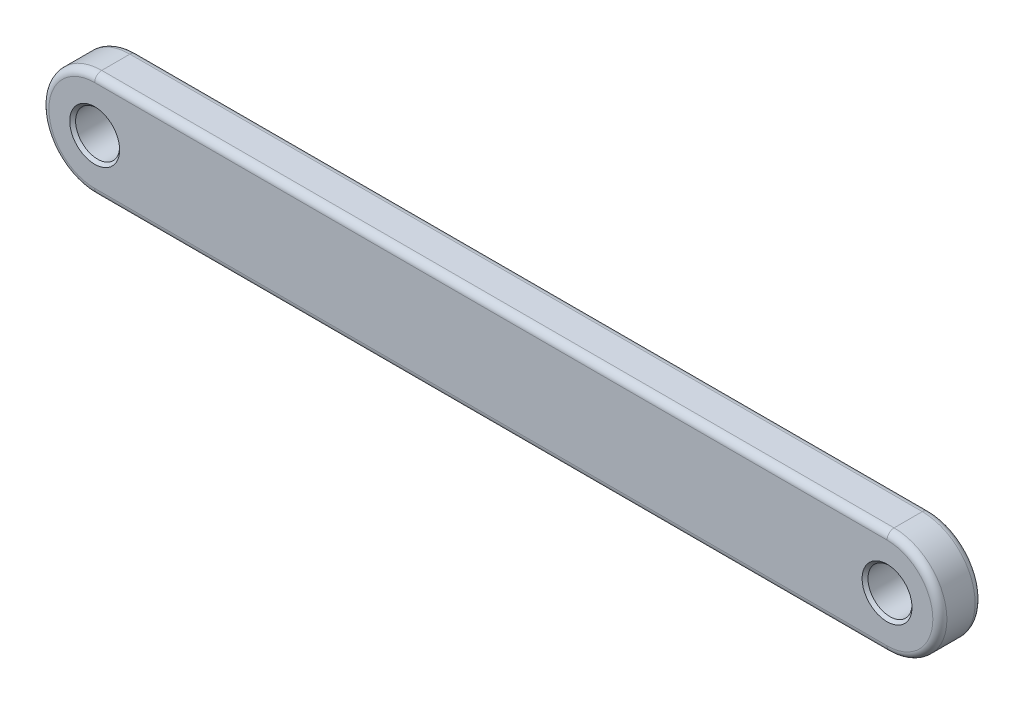
from build123d import *

# Parameters (mm, degrees)
SKETCH1_R           = 3.96875
BOSS_EXTRUDE1_DEPTH = 7.62
FILLET1_R           = 1.27
BOSS_EXTRUDE2_START = 2.116666667
SKETCH2_R           = 5.55625
SKETCH2_R_2         = 3.96875
BOSS_EXTRUDE2_DEPTH = 2.116666667
FILLET2_R           = 1.5875
CHAMFER1_SIZE       = 0.529166836
FILLET3_R           = 0.396875


with BuildPart() as part:
    # Sketch1 → Boss-Extrude1 (new body)
    with BuildSketch(Plane.XY):
        with BuildLine():
            Line((-71.4375, 9.525), (71.4375, 9.525))
            ThreePointArc((71.4375, 9.525), (80.9625, 0), (71.4375, -9.525))
            Line((71.4375, -9.525), (-71.4375, -9.525))
            ThreePointArc((-71.4375, -9.525), (-80.9625, 0), (-71.4375, 9.525))
        make_face()
        with Locations(Location((-71.4375, 0, 0), (0, 0, 180))):
            Circle(SKETCH1_R, mode=Mode.SUBTRACT)
        with Locations(Location((71.4375, 0, 0), (0, 0, 180))):
            Circle(SKETCH1_R, mode=Mode.SUBTRACT)
    extrude(amount=BOSS_EXTRUDE1_DEPTH)

    # Fillet1
    fillet1_edges = [part.edges().sort_by_distance(p)[0] for p in [
        (80.9625, 0, 7.62),
        (0, 9.525, 7.62),
        (-80.9625, 0, 7.62),
        (0, 9.525, 0),
        (80.9625, 0, 0),
        (0, -9.525, 0),
        (-80.9625, 0, 0),
        (0, -9.525, 7.62),
    ]]
    fillet(fillet1_edges, radius=FILLET1_R)

    # Sketch2 → Boss-Extrude2 (add)
    with BuildSketch(Plane(origin=(0, 0, 0), x_dir=(-1, 0, 0), z_dir=(0, 0, -1)).offset(BOSS_EXTRUDE2_START)):
        with Locations(Location((-71.4375, 0, 0), (0, 0, 180))):
            Circle(SKETCH2_R)
        with Locations((-71.4375, 0)):
            Circle(SKETCH2_R_2, mode=Mode.SUBTRACT)
    extrude(amount=-BOSS_EXTRUDE2_DEPTH)

    # Fillet2
    fillet2_edges = [part.edges().sort_by_distance(p)[0] for p in [
        (65.88125, 0, 0),
    ]]
    fillet(fillet2_edges, radius=FILLET2_R)

    # Chamfer1
    chamfer1_edges = [part.edges().sort_by_distance(p)[0] for p in [
        (-67.46875, 0, 0),
        (-67.46875, 0, 7.62),
        (75.40625, 0, 7.62),
        (75.40625, 0, -2.116666667),
    ]]
    chamfer(chamfer1_edges, length=CHAMFER1_SIZE)

    # Fillet3
    fillet3_edges = [part.edges().sort_by_distance(p)[0] for p in [
        (65.88125, 0, -2.116666667),
    ]]
    fillet(fillet3_edges, radius=FILLET3_R)


solid = part.part
